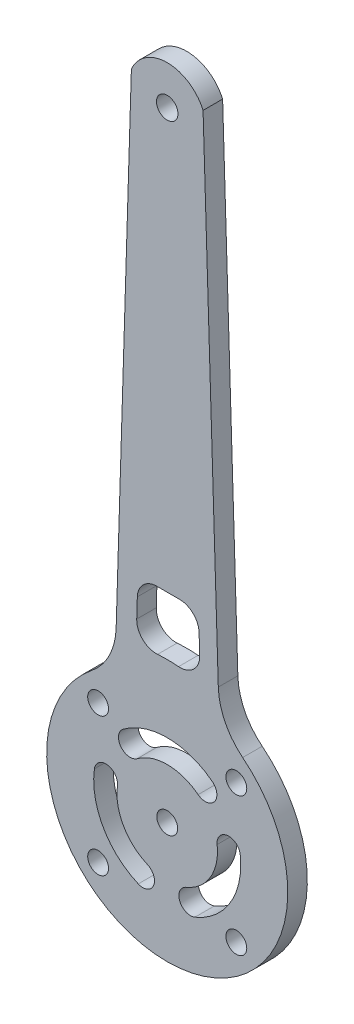
from build123d import *

# Parameters (mm, degrees)
SKETCH_1_R      = 1.65
SKETCH_1_R_2    = 1.6
EXTRUDE_1_DEPTH = 3
FILLET_2_R      = 10
FILLET_3_R      = 3


with BuildPart() as part:
    # 草图1 → 凸台-拉伸1 (new body)
    with BuildSketch(Plane.XY):
        with BuildLine():
            Line((-5.5, 2.397915762), (-8, -78.319172682))
            ThreePointArc((-8, -78.319172682), (0, -113.5), (8, -78.319172682))
            Line((8, -78.319172682), (5.5, 2.397915762))
            ThreePointArc((5.5, 2.397915762), (0, 6), (-5.5, 2.397915762))
        make_face()
        Circle(SKETCH_1_R, mode=Mode.SUBTRACT)
        with Locations((0, -95)):
            Circle(SKETCH_1_R_2, mode=Mode.SUBTRACT)
        with Locations((10.606601718, -84.393398282)):
            Circle(SKETCH_1_R_2, mode=Mode.SUBTRACT)
        with Locations((10.606601718, -105.606601718)):
            Circle(SKETCH_1_R_2, mode=Mode.SUBTRACT)
        with Locations((-10.606601718, -105.606601718)):
            Circle(SKETCH_1_R_2, mode=Mode.SUBTRACT)
        with Locations((-10.606601718, -84.393398282)):
            Circle(SKETCH_1_R_2, mode=Mode.SUBTRACT)
        with BuildLine():
            Line((-4.498993554, -64.390563515), (-4.79259564, -73.870045737))
            ThreePointArc((-4.79259564, -73.870045737), (0.155319711, -73.333901691), (5.095039914, -73.940928121))
            Line((5.095039914, -73.940928121), (4.799242432, -64.390563515))
            Line((4.799242432, -64.390563515), (-4.498993554, -64.390563515))
        make_face(mode=Mode.SUBTRACT)
        with BuildLine():
            ThreePointArc((6.933102995, -86.096444908), (0.107633433, -83.715957043), (-6.762002909, -85.965813425))
            ThreePointArc((-6.762002909, -85.965813425), (-7.121329366, -88.463845995), (-4.623296795, -88.823172453))
            ThreePointArc((-4.623296795, -88.823172453), (0.073590815, -87.284907246), (4.740280844, -88.912487427))
            ThreePointArc((4.740280844, -88.912487427), (7.244713179, -88.600877243), (6.933102995, -86.096444908))
        make_face(mode=Mode.SUBTRACT)
        with BuildLine():
            ThreePointArc((4.244153397, -105.456020867), (9.718451142, -100.735234766), (11.204836531, -93.661026988))
            ThreePointArc((11.204836531, -93.661026988), (9.221140094, -92.100824863), (7.660937969, -94.0845213))
            ThreePointArc((7.660937969, -94.0845213), (6.64467091, -98.921277892), (2.901800112, -102.148959919))
            ThreePointArc((2.901800112, -102.148959919), (1.91944628, -104.473667035), (4.244153397, -105.456020867))
        make_face(mode=Mode.SUBTRACT)
        with BuildLine():
            ThreePointArc((-11.177256391, -93.447534226), (-9.826084575, -100.548808191), (-4.442833622, -105.373159587))
            ThreePointArc((-4.442833622, -105.373159587), (-2.099810728, -104.435329142), (-3.037641173, -102.092306248))
            ThreePointArc((-3.037641173, -102.092306248), (-6.718261725, -98.793814861), (-7.642080956, -93.938552654))
            ThreePointArc((-7.642080956, -93.938552654), (-9.164159459, -91.925455722), (-11.177256391, -93.447534226))
        make_face(mode=Mode.SUBTRACT)
    extrude(amount=EXTRUDE_1_DEPTH)

    # 圆角2
    fillet_2_edges = [part.edges().sort_by_distance(p)[0] for p in [
        (8, -78.319172682, 1.5),
        (-8, -78.319172682, 1.5),
    ]]
    fillet(fillet_2_edges, radius=FILLET_2_R)

    # 圆角3
    fillet_3_edges = [part.edges().sort_by_distance(p)[0] for p in [
        (-4.79259564, -73.870045737, 1.5),
        (5.095039914, -73.940928121, 1.5),
        (4.799242432, -64.390563515, 1.5),
        (-4.498993554, -64.390563515, 1.5),
    ]]
    fillet(fillet_3_edges, radius=FILLET_3_R)


solid = part.part
